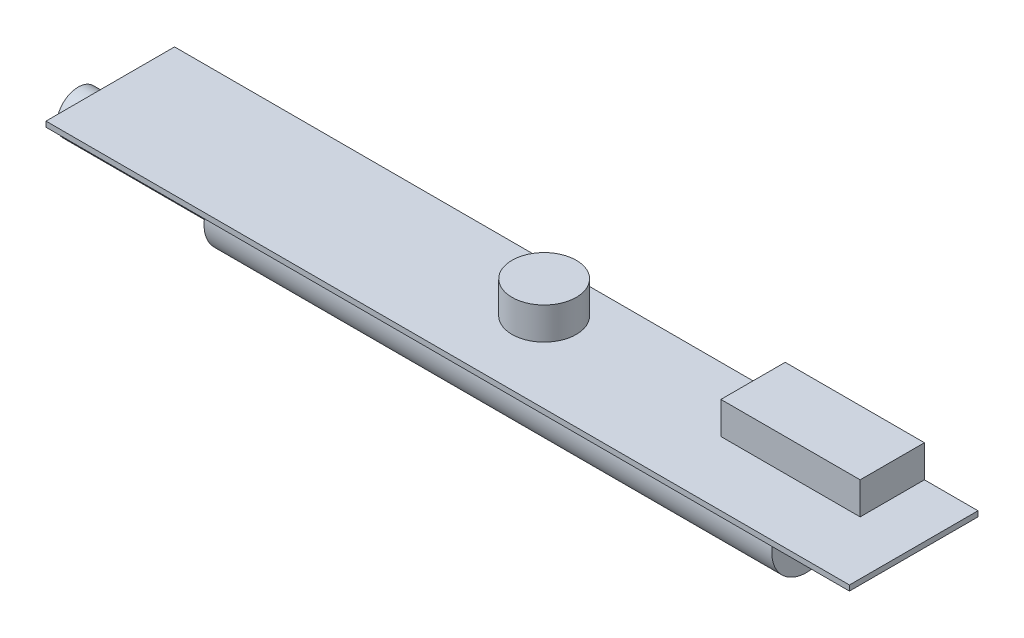
from build123d import *

# Parameters (mm, degrees)
SKETCH1_W             = 75
SKETCH1_H             = 12
BOSS_EXTRUDE1_DEPTH   = 0.5
SKETCH2_R             = 3
BOSS_EXTRUDE2_DEPTH   = 3
SKETCH2_W             = 13
SKETCH2_H             = 6
BOSS_EXTRUDE2_2_DEPTH = 3
BOSS_EXTRUDE3_START   = -10
SKETCH3_R             = 3.25
BOSS_EXTRUDE3_DEPTH   = 53
SKETCH4_R             = 2
BOSS_EXTRUDE4_DEPTH   = 15


with BuildPart() as part:
    # Sketch1 → Boss-Extrude1 (new body)
    with BuildSketch(Plane(origin=(0, 0, 0), x_dir=(1, 0, 0), z_dir=(0, 1, 0))):
        Rectangle(SKETCH1_W, SKETCH1_H)
    extrude(amount=BOSS_EXTRUDE1_DEPTH)


with BuildPart() as body_2:
    # Sketch2 → Boss-Extrude2 (new body)
    with BuildSketch(Plane(origin=(0, 0.5, 0), x_dir=(1, 0, 0), z_dir=(0, 1, 0))):
        with Locations(Location((1.5, 1.5, 0), (0, 0, 270))):
            Circle(SKETCH2_R)
    extrude(amount=BOSS_EXTRUDE2_DEPTH)


with BuildPart() as body_3:
    # Sketch2 → Boss-Extrude2 2 (new body)
    with BuildSketch(Plane(origin=(0, 0.5, 0), x_dir=(1, 0, 0), z_dir=(0, 1, 0))):
        with Locations((26, 3)):
            Rectangle(SKETCH2_W, SKETCH2_H)
    extrude(amount=BOSS_EXTRUDE2_2_DEPTH)


with BuildPart() as body_4:
    # Sketch3 → Boss-Extrude3 (new body)
    with BuildSketch(Plane(origin=(37.5, 0, 0), x_dir=(0, 0, -1), z_dir=(1, 0, 0)).offset(BOSS_EXTRUDE3_START)):
        with Locations((0, -3.25)):
            Circle(SKETCH3_R)
    extrude(amount=-BOSS_EXTRUDE3_DEPTH)

    # Sketch4 → Boss-Extrude4 (add)
    with BuildSketch(Plane.ZY.offset(25.5)):
        with Locations((0, -3.25)):
            Circle(SKETCH4_R)
    extrude(amount=BOSS_EXTRUDE4_DEPTH)


solid = Compound([part.part, body_2.part, body_3.part, body_4.part])
